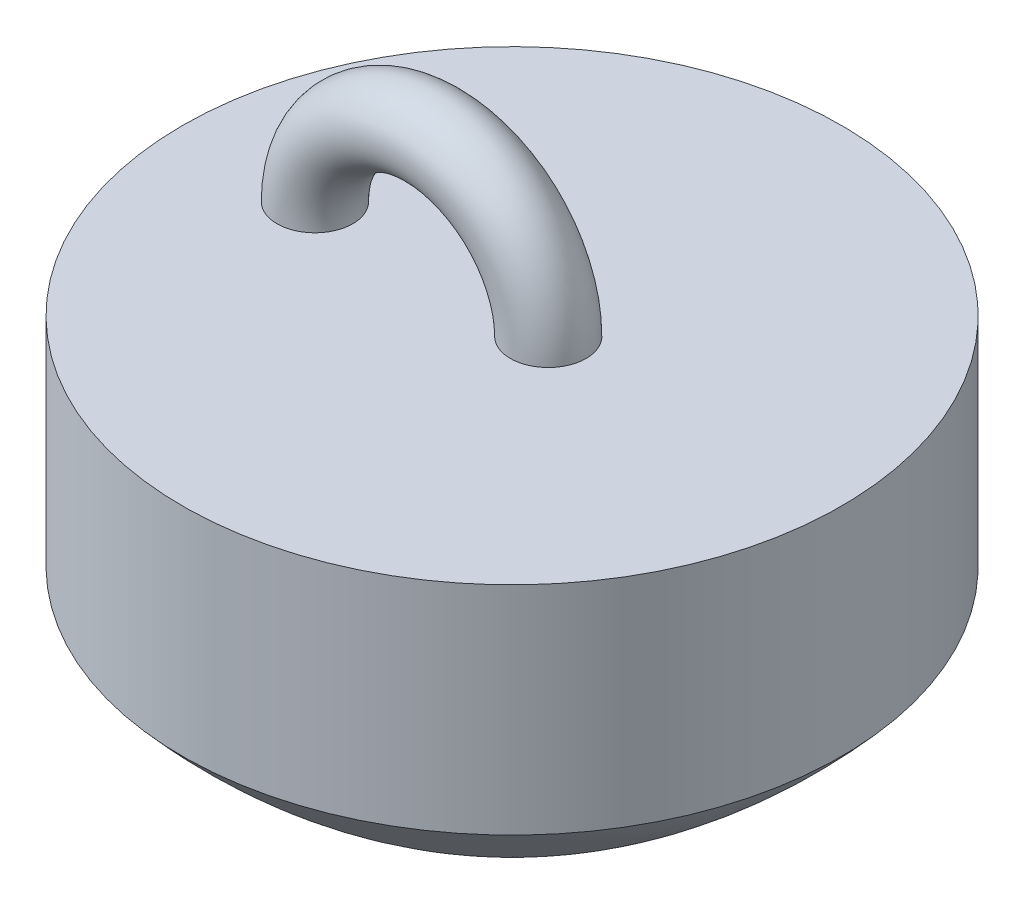
from build123d import *

# Parameters (mm, degrees)
SKETCH2_R = 1.651


with BuildPart() as part:
    # Sketch1 → Revolve1 (revolve)
    with BuildSketch(Plane.XY):
        with BuildLine():
            Line((14.605, -9.086216131), (14.605, -26.604819121))
            ThreePointArc((14.605, -26.604819121), (6.73899884, -23.791196646), (0.254, -18.524771319))
            Line((0.254, -18.524771319), (0.254, -9.086216131))
            Line((0.254, -9.086216131), (14.605, -9.086216131))
        make_face()
    revolve(axis=Axis((14.605, -9.086216131, 0), (0, -1, 0)))

    # Sweep1: sweep along a path in Sketch3
    with BuildLine(Plane.XY) as sweep1_path:
        ThreePointArc((6.019619555, -9.086216131), (11.099619555, -4.006216131), (16.179619555, -9.086216131))
    # Sketch2 → Sweep1 (sweep)
    with BuildSketch(Plane(origin=(0, -9.086216131, 0), x_dir=(1, 0, 0), z_dir=(0, 1, 0))):
        with Locations((6.019619555, 0)):
            Circle(SKETCH2_R)
        with Locations((16.179619555, 0)):
            Circle(SKETCH2_R)
    sweep(path=sweep1_path.line)


solid = part.part
